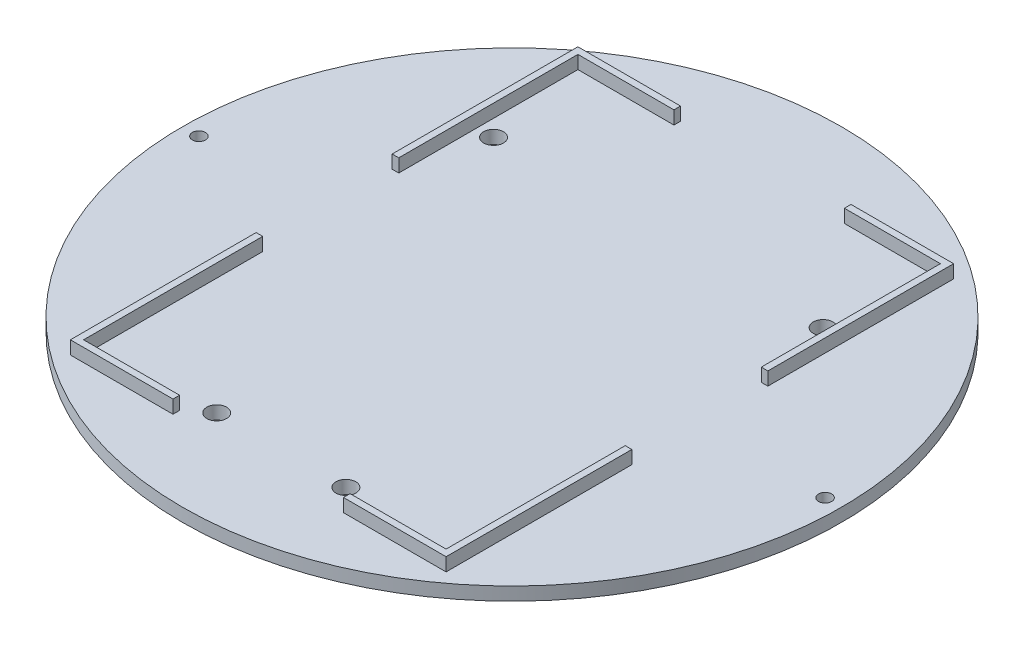
from build123d import *

# Parameters (mm, degrees)
SKETCH1_R           = 50
BOSS_EXTRUDE3_DEPTH = 2
SKETCH3_W           = 57
SKETCH3_H           = 77
SKETCH3_W_2         = 55
SKETCH3_H_2         = 75
BOSS_EXTRUDE4_DEPTH = 2
SKETCH4_W           = 84.733719196
SKETCH4_H           = 20.64189851
CUT_EXTRUDE1_DEPTH  = 2
SKETCH5_W           = 25.866082702
SKETCH5_H           = 94.035315438
CUT_EXTRUDE2_DEPTH  = 2
SKETCH6_R           = 1.5
CUT_EXTRUDE3_DEPTH  = 12
SKETCH7_R           = 1
CUT_EXTRUDE4_DEPTH  = 10.15


with BuildPart() as part:
    # Sketch1 → Boss-Extrude3 (new body)
    with BuildSketch(Plane(origin=(0, 0, 0), x_dir=(1, 0, 0), z_dir=(0, 1, 0))):
        with Locations(Location((0, 0, 0), (0, 0, 270))):
            Circle(SKETCH1_R)
    extrude(amount=BOSS_EXTRUDE3_DEPTH)

    # Sketch3 → Boss-Extrude4 (add)
    with BuildSketch(Plane(origin=(0, 2, 0), x_dir=(1, 0, 0), z_dir=(0, 1, 0))):
        Rectangle(SKETCH3_W, SKETCH3_H)
        Rectangle(SKETCH3_W_2, SKETCH3_H_2, mode=Mode.SUBTRACT)
    extrude(amount=BOSS_EXTRUDE4_DEPTH)

    # Sketch4 → Cut-Extrude1 (cut)
    with BuildSketch(Plane(origin=(0, 4, 0), x_dir=(1, 0, 0), z_dir=(0, 1, 0))):
        Rectangle(SKETCH4_W, SKETCH4_H)
    extrude(amount=-CUT_EXTRUDE1_DEPTH, mode=Mode.SUBTRACT)

    # Sketch5 → Cut-Extrude2 (cut)
    with BuildSketch(Plane(origin=(0, 4, 0), x_dir=(1, 0, 0), z_dir=(0, 1, 0))):
        Rectangle(SKETCH5_W, SKETCH5_H)
    extrude(amount=-CUT_EXTRUDE2_DEPTH, mode=Mode.SUBTRACT)

    # Sketch6 → Cut-Extrude3 (cut)
    with BuildSketch(Plane(origin=(0, 2, 0), x_dir=(1, 0, 0), z_dir=(0, 1, 0))):
        with Locations(Location((25, 22.2, 0), (0, 0, 270))):
            Circle(SKETCH6_R)
        with Locations(Location((-25, 22.2, 0), (0, 0, 270))):
            Circle(SKETCH6_R)
        with Locations(Location((9.8, -35, 0), (0, 0, 270))):
            Circle(SKETCH6_R)
        with Locations(Location((-9.8, -35, 0), (0, 0, 270))):
            Circle(SKETCH6_R)
    extrude(amount=-CUT_EXTRUDE3_DEPTH, mode=Mode.SUBTRACT)

    # Sketch7 → Cut-Extrude4 (cut)
    with BuildSketch(Plane(origin=(0, 2, 0), x_dir=(1, 0, 0), z_dir=(0, 1, 0))):
        with Locations(Location((-47.5, 0, 0), (0, 0, 270))):
            Circle(SKETCH7_R)
        with Locations(Location((47.5, 0, 0), (0, 0, 270))):
            Circle(SKETCH7_R)
    extrude(amount=-CUT_EXTRUDE4_DEPTH, mode=Mode.SUBTRACT)


solid = part.part
